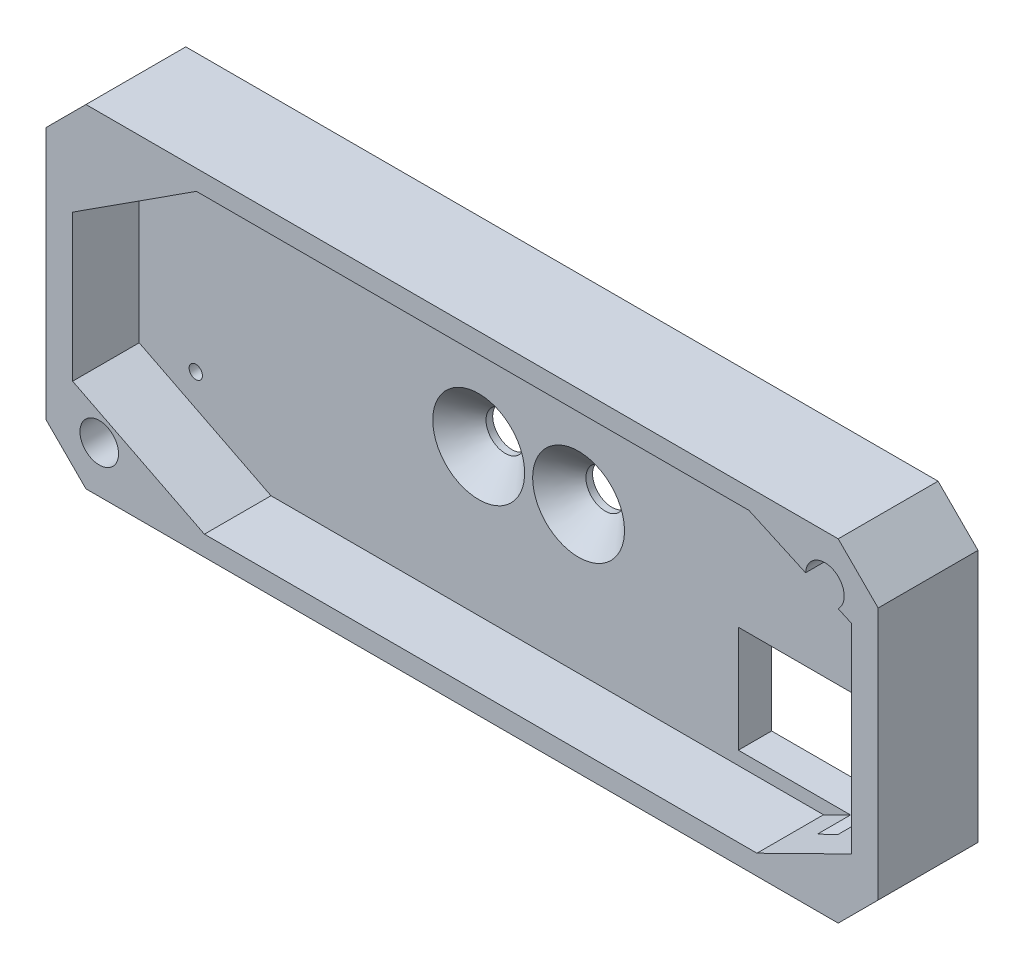
from build123d import *

# Parameters (mm, degrees)
SKETCH_1_W          = 62.5
SKETCH_1_H          = 25
EXTRUDE_1_DEPTH     = 2.5
SKETCH_2_R          = 1.45
CUT_EXTRUDE_1_DEPTH = 3.5
CHAMFER_1_SIZE      = 2
SKETCH_3_W          = 62.5
SKETCH_3_H          = 25
EXTRUDE_2_DEPTH     = 5
SKETCH_4_W          = 10
SKETCH_4_H          = 8
CUT_EXTRUDE_2_DEPTH = 5
SKETCH_5_W          = 67.566121691
SKETCH_5_H          = 29.988395665
CUT_EXTRUDE_3_DEPTH = 10
SKETCH_7_R          = 1.45
CUT_EXTRUDE_4_DEPTH = 10
SKETCH_10_R         = 0.5
CUT_EXTRUDE_5_DEPTH = 10


with BuildPart() as part:
    # Эскиз1 → Бобышка-Вытянуть1 (new body)
    with BuildSketch(Plane.XY):
        Rectangle(SKETCH_1_W, SKETCH_1_H)
    extrude(amount=EXTRUDE_1_DEPTH)

    # Эскиз2 → Вырез-Вытянуть1 (cut)
    with BuildSketch(Plane.XY.offset(2.5)):
        with Locations((3.75, 0)):
            Circle(SKETCH_2_R)
        with Locations((-3.75, 0)):
            Circle(SKETCH_2_R)
    extrude(amount=-CUT_EXTRUDE_1_DEPTH, mode=Mode.SUBTRACT)

    # Фаска1
    chamfer_1_edges = [part.edges().sort_by_distance(p)[0] for p in [
        (2.3, 0, 2.5),
        (-5.2, 0, 2.5),
    ]]
    chamfer(chamfer_1_edges, length=CHAMFER_1_SIZE)

    # Эскиз3 → Бобышка-Вытянуть2 (add)
    with BuildSketch(Plane.XY.offset(2.5)):
        Rectangle(SKETCH_3_W, SKETCH_3_H)
        Polygon((-29.25, -6), (-29.25, 5), (-19.95, 11), (21.55, 11), (29.25, 7.5), (29.25, -7.5), (22.14795897, -11), (-19.35204103, -11), align=None, mode=Mode.SUBTRACT)
    extrude(amount=EXTRUDE_2_DEPTH)

    # Эскиз4 → Вырез-Вытянуть2 (cut)
    with BuildSketch(Plane(origin=(0, 0, 0), x_dir=(-1, 0, 0), z_dir=(0, 0, -1))):
        with Locations((-20.75, -6)):
            Rectangle(SKETCH_4_W, SKETCH_4_H)
    extrude(amount=-CUT_EXTRUDE_2_DEPTH, mode=Mode.SUBTRACT)

    # Эскиз5 → Вырез-Вытянуть3 (cut)
    with BuildSketch(Plane.XY.offset(7.5)):
        with Locations((0.466014855, 0.289583976)):
            Rectangle(SKETCH_5_W, SKETCH_5_H)
        Polygon((-28.25, 12.5), (-31.25, 9.5), (-31.25, -9.5), (-28.25, -12.5), (28.25, -12.5), (31.25, -9.5), (31.25, 9.5), (28.25, 12.5), align=None, mode=Mode.SUBTRACT)
    extrude(amount=-CUT_EXTRUDE_3_DEPTH, mode=Mode.SUBTRACT)

    # Эскиз7 → Вырез-Вытянуть4 (cut)
    with BuildSketch(Plane.XY.offset(7.5)):
        with Locations((-27.25, -9)):
            Circle(SKETCH_7_R)
        with Locations(Location((27.25, 9, 0), (0, 0, 313.779004768))):
            Circle(SKETCH_7_R)
    extrude(amount=-CUT_EXTRUDE_4_DEPTH, mode=Mode.SUBTRACT)

    # Эскиз10 → Вырез-Вытянуть5 (cut)
    with BuildSketch(Plane.XY.offset(2.5)):
        with Locations((-25, -5.766085635)):
            Circle(SKETCH_10_R)
        with Locations((26.547958971, 6)):
            Circle(SKETCH_10_R)
    extrude(amount=-CUT_EXTRUDE_5_DEPTH, mode=Mode.SUBTRACT)


solid = part.part
